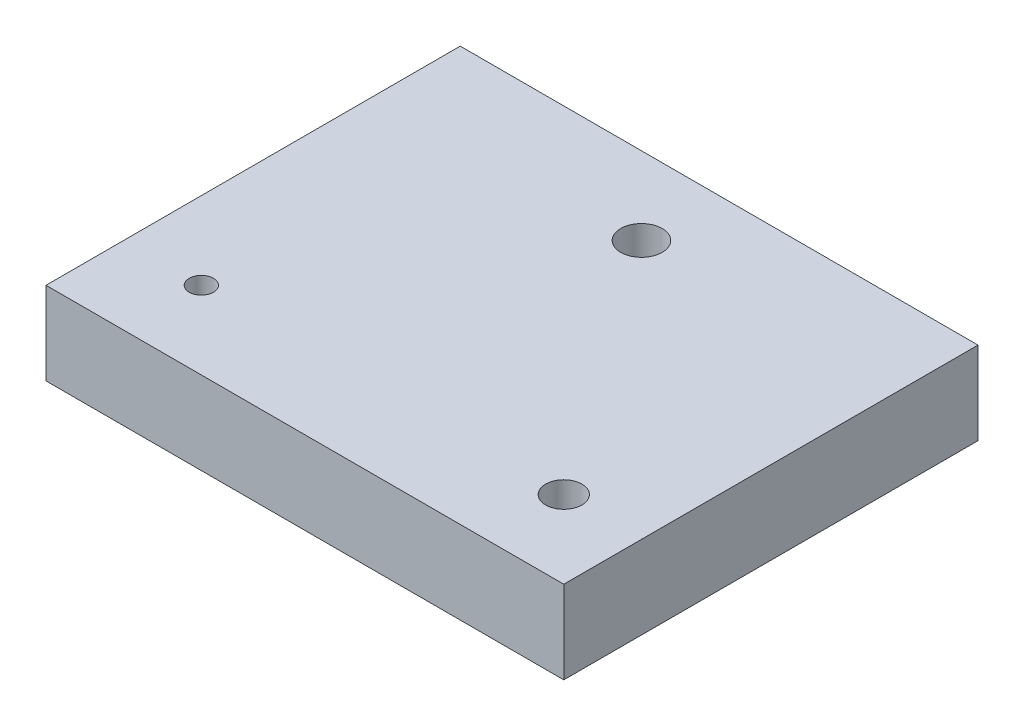
from build123d import *

# Parameters (mm, degrees)
SKETCH_1_W      = 100
SKETCH_1_H      = 80
SKETCH_1_R      = 2.342606428
SKETCH_1_R_2    = 3.5
SKETCH_1_R_3    = 4
EXTRUDE_1_DEPTH = 16


with BuildPart() as part:
    # 草图1 → 凸台-拉伸1 (new body)
    with BuildSketch(Plane(origin=(0, 0, 0), x_dir=(1, 0, 0), z_dir=(0, 1, 0))):
        Rectangle(SKETCH_1_W, SKETCH_1_H)
        with Locations(Location((-35, -25, 0), (0, 0, 270))):
            Circle(SKETCH_1_R, mode=Mode.SUBTRACT)
        with Locations(Location((35, -25, 0), (0, 0, 270))):
            Circle(SKETCH_1_R_2, mode=Mode.SUBTRACT)
        with Locations(Location((0, 25, 0), (0, 0, 270))):
            Circle(SKETCH_1_R_3, mode=Mode.SUBTRACT)
    extrude(amount=EXTRUDE_1_DEPTH)


solid = part.part
